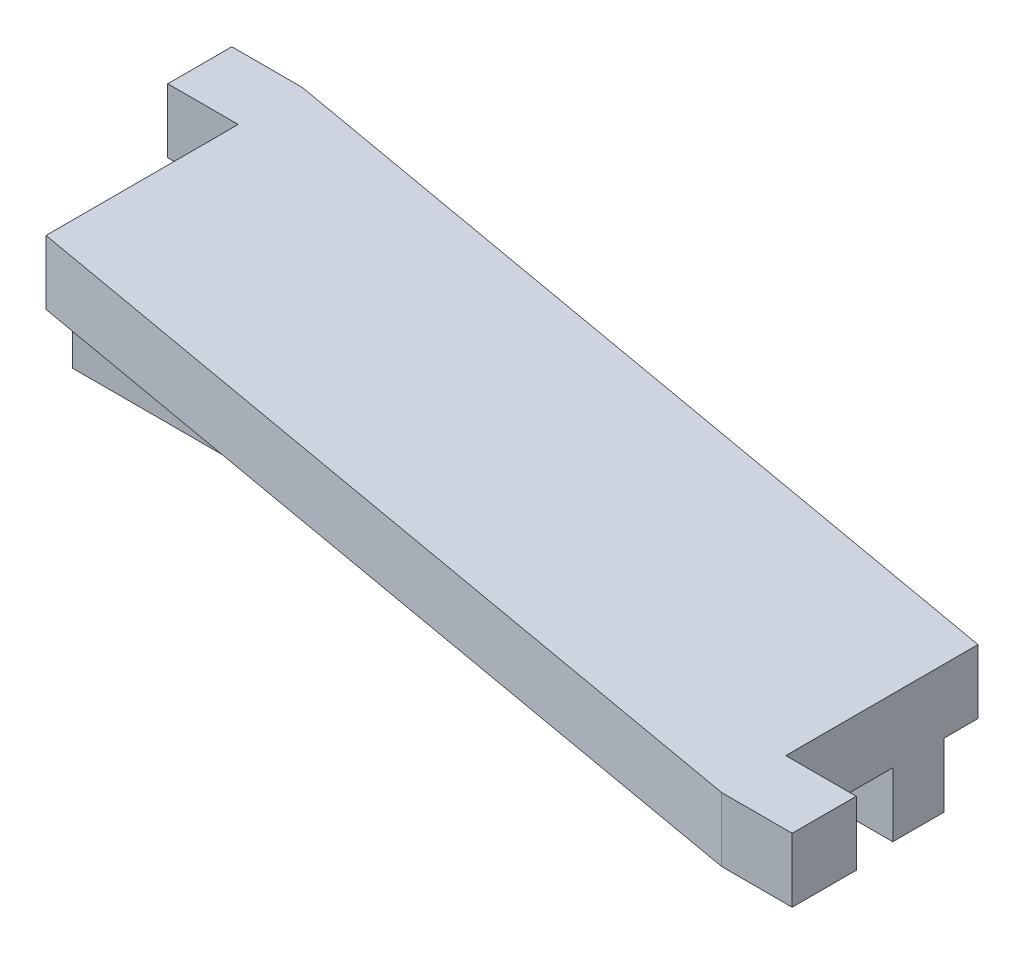
from build123d import *

# Parameters (mm, degrees)
BOSS_EXTRUDE1_DEPTH = 10
SKETCH6_W           = 128.025007892
SKETCH6_H           = 8
BOSS_EXTRUDE3_DEPTH = 10


with BuildPart() as part:
    # Sketch1 → Boss-Extrude1 (new body)
    with BuildSketch(Plane(origin=(0, 0, 0), x_dir=(1, 0, 0), z_dir=(0, 1, 0))):
        Polygon((0, 0), (-128.025007892, 22.574263097), (-128.025007892, 52.574263097), (-139.025007892, 52.574263097), (-139.025007892, 62.574263097), (-128.025007892, 62.574263097), (0, 40), (0, 10), (11, 10), (11, 0), align=None)
    extrude(amount=BOSS_EXTRUDE1_DEPTH)

    # Sketch6 → Boss-Extrude3 (add)
    with BuildSketch(Plane.XZ):
        with Locations((-64.012503946, -30.7)):
            Rectangle(SKETCH6_W, SKETCH6_H)
    extrude(amount=BOSS_EXTRUDE3_DEPTH)


solid = part.part
